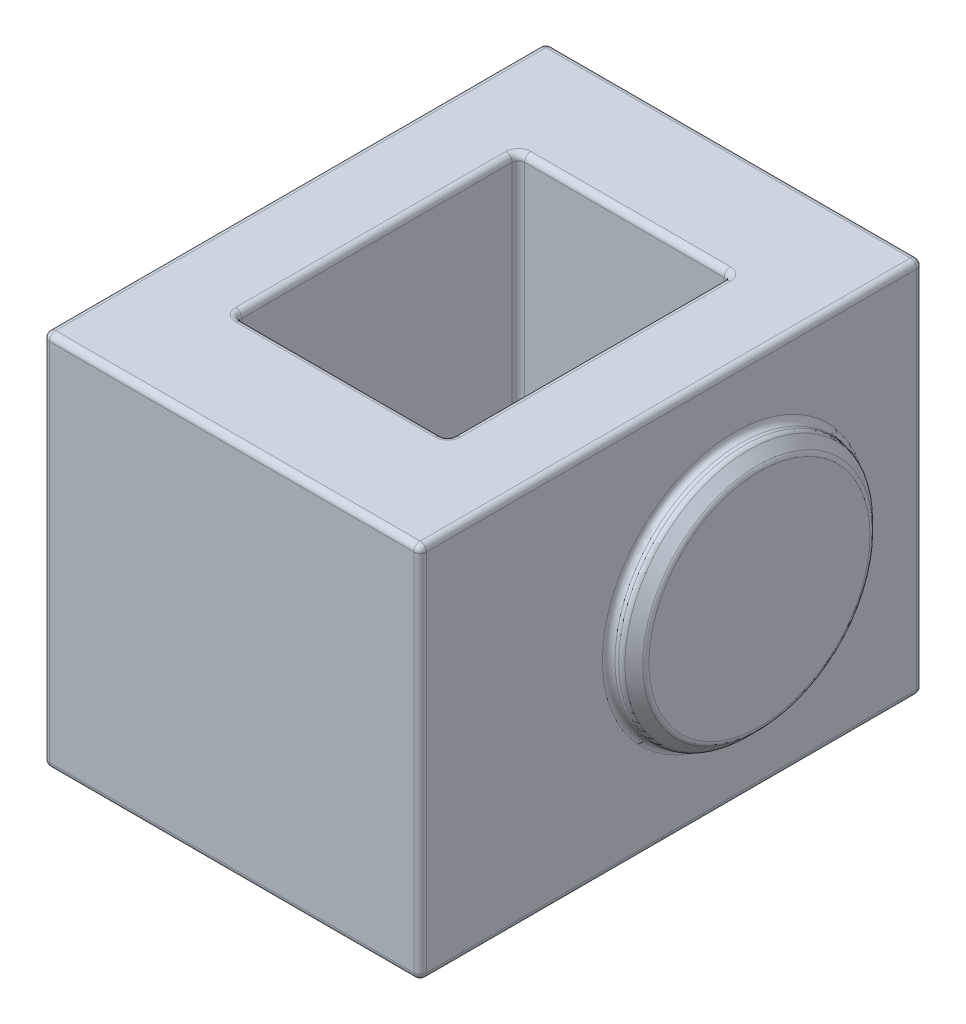
from build123d import *

# Parameters (mm, degrees)
SKETCH1_W           = 60
SKETCH1_H           = 80
SKETCH1_W_2         = 33.75
SKETCH1_H_2         = 45
BOSS_EXTRUDE1_DEPTH = 60
SKETCH2_R           = 20
BOSS_EXTRUDE2_DEPTH = 4
CHAMFER1_SIZE       = 2
FILLET1_R           = 1


with BuildPart() as part:
    # Sketch1 → Boss-Extrude1 (new body)
    with BuildSketch(Plane(origin=(0, 0, 0), x_dir=(1, 0, 0), z_dir=(0, 1, 0))):
        Rectangle(SKETCH1_W, SKETCH1_H)
        Rectangle(SKETCH1_W_2, SKETCH1_H_2, mode=Mode.SUBTRACT)
    extrude(amount=BOSS_EXTRUDE1_DEPTH)

    # Sketch2 → Boss-Extrude2 (add)
    with BuildSketch(Plane(origin=(30, 0, 0), x_dir=(0, 0, -1), z_dir=(1, 0, 0))):
        with Locations((10, 30)):
            Circle(SKETCH2_R)
    extrude(amount=BOSS_EXTRUDE2_DEPTH)

    # Chamfer1
    chamfer1_edges = [part.edges().sort_by_distance(p)[0] for p in [
        (34, 30, 10),
    ]]
    chamfer(chamfer1_edges, length=CHAMFER1_SIZE)

    # Fillet1
    fillet1_edges = [part.edges().sort_by_distance(p)[0] for p in [
        (-30, 60, 0),
        (16.875, 0, 0),
        (16.875, 30, 22.5),
        (0, 0, -22.5),
        (16.875, 30, -22.5),
        (-16.875, 0, 0),
        (-16.875, 30, -22.5),
        (0, 0, 22.5),
        (-16.875, 30, 22.5),
        (16.875, 60, 0),
        (0, 60, 40),
        (0, 60, -22.5),
        (-16.875, 60, 0),
        (0, 60, 22.5),
        (30, 30, 10),
        (34, 30, 8),
        (32, 30, 10),
        (30, 60, 0),
        (0, 0, 40),
        (-30, 0, 0),
        (0, 0, -40),
        (30, 0, 0),
        (30, 30, 40),
        (-30, 30, 40),
        (-30, 30, -40),
        (30, 30, -40),
        (0, 60, -40),
    ]]
    fillet(fillet1_edges, radius=FILLET1_R)


solid = part.part
